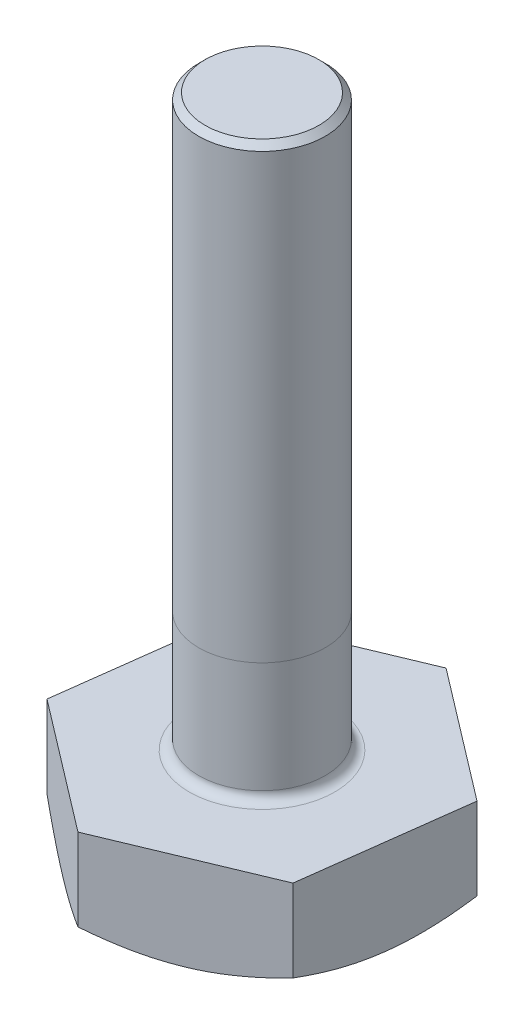
from build123d import *

# Parameters (mm, degrees)
BOSS_EXTRUDE2_DEPTH = 1.5
SKETCH3_OUTSIDE_W   = 13.432
SKETCH3_OUTSIDE_H   = 13.79
SKETCH3_OUTSIDE_R   = 2.25
CUT_EXTRUDE2_DEPTH  = 1.5
CUT_EXTRUDE2_DRAFT  = 60
SKETCH4_R           = 1
BOSS_EXTRUDE3_DEPTH = 9
CHAMFER1_SIZE       = 0.1
FILLET1_R           = 0.15


with BuildPart() as part:
    # Sketch1 → Boss-Extrude2 (new body)
    with BuildSketch(Plane(origin=(0, 0, 0), x_dir=(1, 0, 0), z_dir=(0, 1, 0))):
        Polygon((2.065411664, -1.576094749), (2.397643923, 1.000651596), (0.332232259, 2.576746345), (-2.065411664, 1.576094749), (-2.397643923, -1.000651596), (-0.332232259, -2.576746345), align=None)
    extrude(amount=BOSS_EXTRUDE2_DEPTH)


with BuildPart() as cut_extrude2_tool:
    # Sketch3 outside → Cut-Extrude2 (with draft: the straight prism first)
    with BuildSketch(Plane(origin=(0, 0, 0), x_dir=(1, 0, 0), z_dir=(0, 1, 0))):
        Rectangle(SKETCH3_OUTSIDE_W, SKETCH3_OUTSIDE_H)
        Circle(SKETCH3_OUTSIDE_R, mode=Mode.SUBTRACT)
    extrude(amount=CUT_EXTRUDE2_DEPTH)
    # Cut-Extrude2: the draft: its side faces are tilted about the plane it starts from
    cut_extrude2_sides = [cut_extrude2_tool.faces().sort_by_distance(p)[0] for p in [
        (0, 0.75, 6.895),
        (6.716, 0.75, 0),
        (0, 0.75, -6.895),
        (-6.716, 0.75, 0),
        (-2.25, 0.75, 0),
    ]]
    draft(cut_extrude2_sides, Plane(origin=(0, 0, 0), x_dir=(1, 0, 0), z_dir=(0, 1, 0)), CUT_EXTRUDE2_DRAFT)


with BuildPart() as part_1:
    add(part.part)

    # Cut-Extrude2: cut by cut_extrude2_tool
    add(cut_extrude2_tool.part, mode=Mode.SUBTRACT)

    # Sketch4 → Boss-Extrude3 (add)
    with BuildSketch(Plane(origin=(0, 1.5, 0), x_dir=(1, 0, 0), z_dir=(0, 1, 0))):
        with Locations(Location((0, 0, 0), (0, 0, 270))):
            Circle(SKETCH4_R)
    extrude(amount=BOSS_EXTRUDE3_DEPTH)

    # Chamfer1
    chamfer1_edges = [part_1.edges().sort_by_distance(p)[0] for p in [
        (0, 10.5, -1),
    ]]
    chamfer(chamfer1_edges, length=CHAMFER1_SIZE)

    # Fillet1
    fillet1_edges = [part_1.edges().sort_by_distance(p)[0] for p in [
        (0, 1.5, -1),
    ]]
    fillet(fillet1_edges, radius=FILLET1_R)


solid = part_1.part
